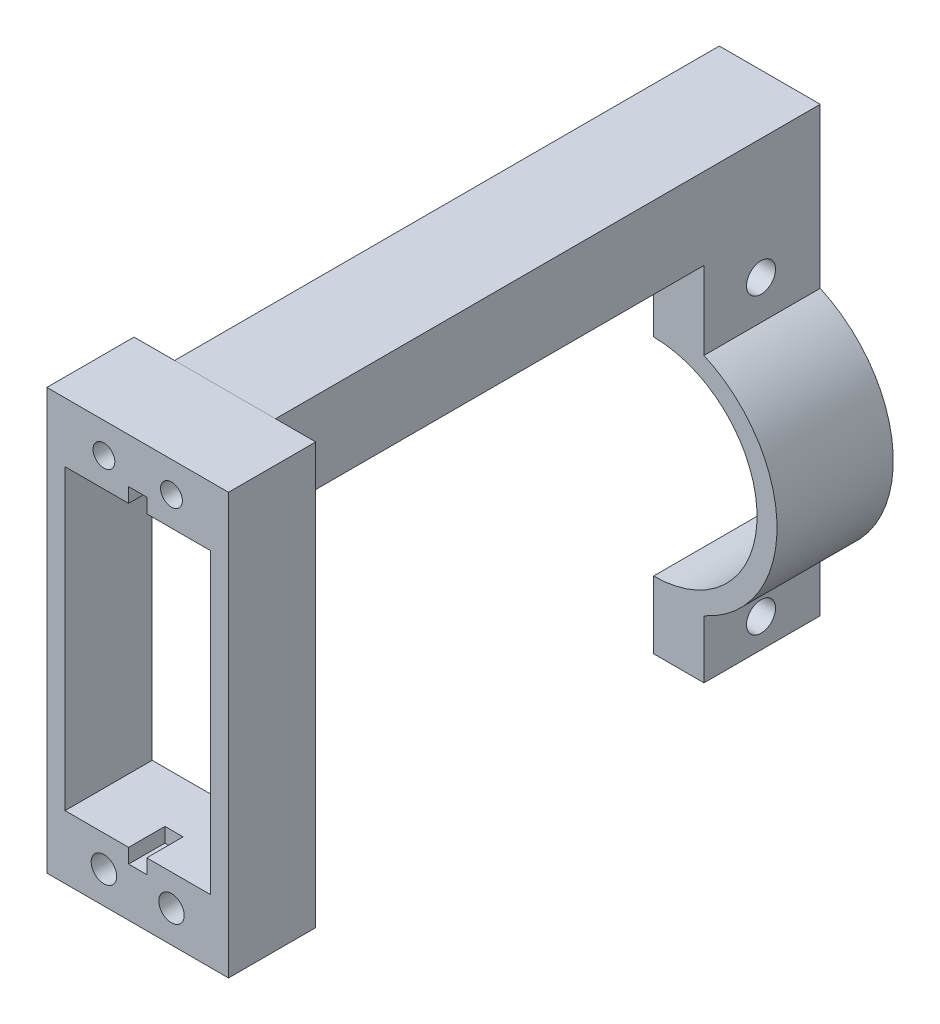
from build123d import *

# Parameters (mm, degrees)
SKETCH_14_W          = 13.892097438
SKETCH_14_H          = 8.107274344
EXTRUDE_7_DEPTH      = 75
EXTRUDE_15_DEPTH     = 12
SKETCH_21_R          = 17
SKETCH_21_R_2        = 14.25
EXTRUDE_16_DEPTH     = 6
EXTRUDE_17_DEPTH     = 6
CUT_EXTRUDE_3_DEPTH  = 6
EXTRUDE_START        = 10
EXTRUDE_18_DEPTH     = 10
SKETCH_26_R          = 2
CUT_EXTRUDE_5_DEPTH  = 102.624375612
SKETCH_27_W          = 25
SKETCH_27_H          = 59
SKETCH_27_R          = 1.75
SKETCH_27_R_2        = 1.5
SKETCH_27_W_2        = 20
SKETCH_27_H_2        = 41
EXTRUDE_20_DEPTH     = 12
SKETCH_29_W          = 25
SKETCH_29_H          = 12
EXTRUDE_21_DEPTH     = 2
SKETCH_31_W          = 13.892097438
SKETCH_31_H          = 75
EXTRUDE_22_DEPTH     = 3.1
SKETCH_33_W          = 25
SKETCH_33_H          = 12
CUT_EXTRUDE_8_DEPTH  = 3.1
CUT_EXTRUDE_START    = -7
SKETCH_34_R          = 1.5
CUT_EXTRUDE_9_DEPTH  = 7
SKETCH_35_W          = 2.5
SKETCH_35_H          = 2
CUT_EXTRUDE_10_DEPTH = 5


with BuildPart() as part:
    # 草圖14 → 填料-伸長7 (new body)
    with BuildSketch(Plane(origin=(0, 0, -8), x_dir=(-1, 0, 0), z_dir=(0, 0, -1))):
        with Locations((-2.293750102, 52.915857713)):
            Rectangle(SKETCH_14_W, SKETCH_14_H)
    extrude(amount=EXTRUDE_7_DEPTH)

    # 草圖15 → 填料-伸長15 (add)
    with BuildSketch(Plane.XZ.offset(-48.862220541)):
        Polygon((2.293750102, -83), (-4.652298617, -83), (-4.652298617, -77), (2.293750102, -77), (9.239798821, -77), (9.239798821, -83), align=None)
    extrude(amount=EXTRUDE_15_DEPTH)

    # 草圖21 → 填料-伸長16 (add)
    with BuildSketch(Plane.XY.offset(-77)):
        with Locations((2.293750102, 22.612220541)):
            Circle(SKETCH_21_R)
        with Locations((2.293750102, 22.612220541)):
            Circle(SKETCH_21_R_2, mode=Mode.SUBTRACT)
    extrude(amount=-EXTRUDE_16_DEPTH)

    # 草圖22 → 填料-伸長17 (add)
    with BuildSketch(Plane.XY.offset(-77)):
        with BuildLine():
            Line((-4.652298617, 7.096022321), (-4.652298617, -0.903977679))
            Line((-4.652298617, -0.903977679), (9.239798821, -0.903977679))
            Line((9.239798821, -0.903977679), (9.239798821, 7.096022321))
            ThreePointArc((9.239798821, 7.096022321), (2.293750102, 5.612220541), (-4.652298617, 7.096022321))
        make_face()
    extrude(amount=-EXTRUDE_17_DEPTH)

    # 草圖23 → 除料-伸長3 (cut)
    with BuildSketch(Plane.XY.offset(-77)):
        with BuildLine():
            Line((2.293750102, 48.862220541), (2.293750102, 36.862220541))
            ThreePointArc((2.293750102, 36.862220541), (-11.956249898, 22.612220541), (2.293750102, 8.362220541))
            Line((2.293750102, 8.362220541), (2.293750102, -0.903977679))
            Line((2.293750102, -0.903977679), (-4.652298617, -0.903977679))
            Line((-4.652298617, -0.903977679), (-4.652298617, 7.096022321))
            ThreePointArc((-4.652298617, 7.096022321), (-14.706249898, 22.612220541), (-4.652298617, 38.12841876))
            Line((-4.652298617, 38.12841876), (-4.652298617, 48.862220541))
            Line((-4.652298617, 48.862220541), (2.293750102, 48.862220541))
        make_face()
    extrude(amount=-CUT_EXTRUDE_3_DEPTH, mode=Mode.SUBTRACT)

    # 草圖25 → 填料-伸長18 (add)
    with BuildSketch(Plane.XY.offset(-77).offset(EXTRUDE_START)):
        with BuildLine():
            Line((2.293750102, -0.903977679), (9.239798821, -0.903977679))
            Line((9.239798821, -0.903977679), (9.239798821, 7.096022321))
            ThreePointArc((9.239798821, 7.096022321), (19.293750102, 22.612220541), (9.239798821, 38.12841876))
            Line((9.239798821, 38.12841876), (9.239798821, 48.862220541))
            Line((9.239798821, 48.862220541), (2.293750102, 48.862220541))
            Line((2.293750102, 48.862220541), (2.293750102, 36.862220541))
            ThreePointArc((2.293750102, 36.862220541), (16.543750102, 22.612220541), (2.293750102, 8.362220541))
            Line((2.293750102, 8.362220541), (2.293750102, -0.903977679))
        make_face()
    extrude(amount=-EXTRUDE_18_DEPTH)

    # 草圖26 → 除料-伸長5 (cut, through all)
    with BuildSketch(Plane(origin=(9.239798821, 0, 0), x_dir=(0, 0, -1), z_dir=(1, 0, 0))):
        with Locations((74.853766884, 3.096022321)):
            Circle(SKETCH_26_R)
        with Locations((74.853766884, 43.49531965)):
            Circle(SKETCH_26_R)
    extrude(amount=-CUT_EXTRUDE_5_DEPTH, mode=Mode.SUBTRACT)

    # 草圖27 → 填料-伸長20 (add)
    with BuildSketch(Plane.XY.offset(-8)):
        with Locations((2.293750102, 28.596022321)):
            Rectangle(SKETCH_27_W, SKETCH_27_H)
        with Locations((-2.356249898, 6.596022321)):
            Circle(SKETCH_27_R, mode=Mode.SUBTRACT)
        with Locations((6.943750102, 6.596022321)):
            Circle(SKETCH_27_R, mode=Mode.SUBTRACT)
        with Locations(Location((-2.356249898, 55.896022321, 0), (0, 0, 134.303638859))):
            Circle(SKETCH_27_R_2, mode=Mode.SUBTRACT)
        with Locations(Location((6.943750102, 55.896022321, 0), (0, 0, 134.303638859))):
            Circle(SKETCH_27_R_2, mode=Mode.SUBTRACT)
        with Locations((2.293750102, 31.396022321)):
            Rectangle(SKETCH_27_W_2, SKETCH_27_H_2, mode=Mode.SUBTRACT)
    extrude(amount=EXTRUDE_20_DEPTH)

    # 草圖29 → 填料-伸長21 (add)
    with BuildSketch(Plane(origin=(0, 58.096022321, 0), x_dir=(1, 0, 0), z_dir=(0, 1, 0))):
        with Locations((2.293750102, 2)):
            Rectangle(SKETCH_29_W, SKETCH_29_H)
    extrude(amount=EXTRUDE_21_DEPTH)

    # 草圖31 → 填料-伸長22 (add)
    with BuildSketch(Plane(origin=(0, 56.969494885, 0), x_dir=(1, 0, 0), z_dir=(0, 1, 0))):
        with Locations((2.293750102, 45.5)):
            Rectangle(SKETCH_31_W, SKETCH_31_H)
    extrude(amount=EXTRUDE_22_DEPTH)

    # 草圖33 → 除料-伸長8 (cut)
    with BuildSketch(Plane.XZ.offset(0.903977679)):
        with Locations((2.293750102, -2)):
            Rectangle(SKETCH_33_W, SKETCH_33_H)
    extrude(amount=-CUT_EXTRUDE_8_DEPTH, mode=Mode.SUBTRACT)

    # 草圖34 → 除料-伸長9 (cut)
    with BuildSketch(Plane.XY.offset(-8).offset(CUT_EXTRUDE_START)):
        with Locations((6.943750102, 55.896022321)):
            Circle(SKETCH_34_R)
        with Locations((-2.356249898, 55.896022321)):
            Circle(SKETCH_34_R)
    extrude(amount=CUT_EXTRUDE_9_DEPTH, mode=Mode.SUBTRACT)

    # 草圖35 → 除料-伸長10 (cut)
    with BuildSketch(Plane.XY.offset(4)):
        with Locations((2.293750102, 52.896022321)):
            Rectangle(SKETCH_35_W, SKETCH_35_H)
        with Locations((2.293750102, 9.896022321)):
            Rectangle(SKETCH_35_W, SKETCH_35_H)
    extrude(amount=-CUT_EXTRUDE_10_DEPTH, mode=Mode.SUBTRACT)


solid = part.part
